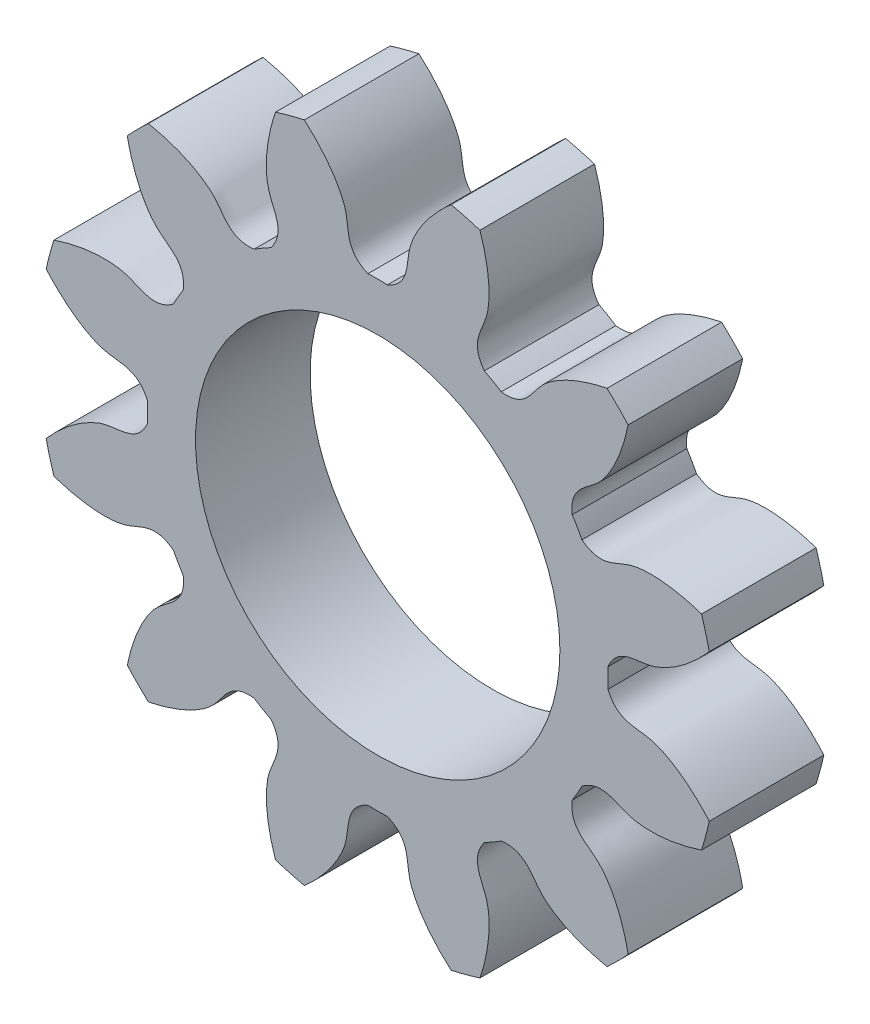
from build123d import *

# Parameters (mm, degrees)
SKETCH_1_R               = 11.853333339
EXTRUDE_1_DEPTH          = 4
CUT_EXTRUDE_1_DEPTH      = 18.233775631
PATTERN_CIRCULAR_1_COUNT = 12
SKETCH_4_R               = 6.36
CUT_EXTRUDE_2_DEPTH      = 10


with BuildPart() as part:
    # 草图1 → 凸台-拉伸1 (new body)
    with BuildSketch(Plane.XY):
        Circle(SKETCH_1_R)
    extrude(amount=EXTRUDE_1_DEPTH)

    # 草图2 → 切除-拉伸1 (cut, through all)
    with BuildSketch(Plane.XY):
        with BuildLine():
            ThreePointArc((0.340089257, 8.036140266), (0, 8.043333332), (-0.340089257, 8.036140266))
            add(Edge.make_bspline(
                [(-0.340089257, 8.036140266), (-1.152802485, 8.380827302), (-0.972605757, 9.050559634), (-1.144951038, 9.63418711), (-1.155909726, 9.668773713), (-1.168784811, 9.706751265), (-1.183712591, 9.748056173), (-1.200831778, 9.792619882), (-1.220277833, 9.840369901), (-1.242184563, 9.891229553), (-1.26668349, 9.945118118), (-1.293903901, 10.001950868), (-1.323972693, 10.061639127), (-1.357014279, 10.124090335), (-1.393150483, 10.189208114), (-1.432500435, 10.25689233), (-1.475180474, 10.327039167), (-1.521304041, 10.399541199), (-1.570981591, 10.474287463), (-1.62432049, 10.551163535), (-1.681424925, 10.630051615), (-1.74239581, 10.710830603), (-1.807330697, 10.793376185), (-1.876323688, 10.877560923), (-1.94946535, 10.963254337), (-2.026842632, 11.050323004), (-2.108538779, 11.138630643), (-2.194633261, 11.228038218), (-2.28520169, 11.318404026), (-2.380315749, 11.409583805), (-2.480043117, 11.501430831), (-2.584447403, 11.593796018), (-2.693588078, 11.686528027), (-2.807520411, 11.779473372), (-2.926295405, 11.872476524), (-3.049959741, 11.965380024), (-3.178555721, 12.058024596), (-3.312121213, 12.150249252), (-3.450689601, 12.241891415), (-3.594289737, 12.332787027), (-3.742945897, 12.422770671), (-3.896677735, 12.511675685), (-4.055500247, 12.599334283), (-4.219423733, 12.685577674), (-4.388453763, 12.770236183), (-4.562591149, 12.853139375), (-4.741831913, 12.934116174), (-4.926167263, 13.012994989), (-5.115583581, 13.08960384), (-5.31006237, 13.163770481), (-5.578482967, 13.260032674), (-5.783738495, 13.326705048), (-5.922611814, 13.368817405)],
                knots=[0, 0, 0, 0, 0.218015236, 0.222043642, 0.226545979, 0.231522246, 0.236972443, 0.24289657, 0.249294627, 0.256166614, 0.263512532, 0.271332379, 0.279626157, 0.288393865, 0.297635503, 0.307351072, 0.31754057, 0.328203999, 0.339341357, 0.350952646, 0.363037866, 0.375597015, 0.388630094, 0.402137104, 0.416118043, 0.430572913, 0.445501713, 0.460904444, 0.476781104, 0.493131694, 0.509956215, 0.527254666, 0.545027047, 0.563273358, 0.581993599, 0.601187771, 0.620855872, 0.640997904, 0.661613866, 0.682703758, 0.704267581, 0.726305333, 0.748817015, 0.771802628, 0.795262171, 0.819195644, 0.843603047, 0.868484381, 0.893839644, 0.919668838, 0.945971962, 1, 1, 1, 1], degree=3))
            ThreePointArc((-5.922611814, 13.368817405), (0, 14.621990614), (5.922611814, 13.368817405))
            add(Edge.make_bspline(
                [(0.340089257, 8.036140266), (1.152802485, 8.380827302), (0.972605757, 9.050559634), (1.144951038, 9.63418711), (1.155909726, 9.668773713), (1.168784811, 9.706751265), (1.183712591, 9.748056173), (1.200831778, 9.792619882), (1.220277833, 9.840369901), (1.242184563, 9.891229553), (1.26668349, 9.945118118), (1.293903901, 10.001950868), (1.323972693, 10.061639127), (1.357014279, 10.124090335), (1.393150483, 10.189208114), (1.432500435, 10.25689233), (1.475180474, 10.327039167), (1.521304041, 10.399541199), (1.570981591, 10.474287463), (1.62432049, 10.551163535), (1.681424925, 10.630051615), (1.74239581, 10.710830603), (1.807330697, 10.793376185), (1.876323688, 10.877560923), (1.94946535, 10.963254337), (2.026842632, 11.050323004), (2.108538779, 11.138630643), (2.194633261, 11.228038218), (2.28520169, 11.318404026), (2.380315749, 11.409583805), (2.480043117, 11.501430831), (2.584447403, 11.593796018), (2.693588078, 11.686528027), (2.807520411, 11.779473372), (2.926295405, 11.872476524), (3.049959741, 11.965380024), (3.178555721, 12.058024596), (3.312121213, 12.150249252), (3.450689601, 12.241891415), (3.594289737, 12.332787027), (3.742945897, 12.422770671), (3.896677735, 12.511675685), (4.055500247, 12.599334283), (4.219423733, 12.685577674), (4.388453763, 12.770236183), (4.562591149, 12.853139375), (4.741831913, 12.934116174), (4.926167263, 13.012994989), (5.115583581, 13.08960384), (5.31006237, 13.163770481), (5.578482967, 13.260032674), (5.783738495, 13.326705048), (5.922611814, 13.368817405)],
                knots=[0, 0, 0, 0, 0.218015236, 0.222043642, 0.226545979, 0.231522246, 0.236972443, 0.24289657, 0.249294627, 0.256166614, 0.263512532, 0.271332379, 0.279626157, 0.288393865, 0.297635503, 0.307351072, 0.31754057, 0.328203999, 0.339341357, 0.350952646, 0.363037866, 0.375597015, 0.388630094, 0.402137104, 0.416118043, 0.430572913, 0.445501713, 0.460904444, 0.476781104, 0.493131694, 0.509956215, 0.527254666, 0.545027047, 0.563273358, 0.581993599, 0.601187771, 0.620855872, 0.640997904, 0.661613866, 0.682703758, 0.704267581, 0.726305333, 0.748817015, 0.771802628, 0.795262171, 0.819195644, 0.843603047, 0.868484381, 0.893839644, 0.919668838, 0.945971962, 1, 1, 1, 1], degree=3))
        make_face()
    cut_extrude_1 = extrude(amount=CUT_EXTRUDE_1_DEPTH, mode=Mode.SUBTRACT)

    # 阵列(圆周)1: 切除-拉伸1 ×12 about axis
    pattern_circular_1_axis = Axis((0, 0, -0.2), (0, 0, 1))
    for i in range(1, PATTERN_CIRCULAR_1_COUNT):
        add(cut_extrude_1.rotate(pattern_circular_1_axis, i * 360 / PATTERN_CIRCULAR_1_COUNT), mode=Mode.SUBTRACT)

    # 草图4 → 切除-拉伸2 (cut)
    with BuildSketch(Plane.XY.offset(4)):
        Circle(SKETCH_4_R)
    extrude(amount=-CUT_EXTRUDE_2_DEPTH, mode=Mode.SUBTRACT)


solid = part.part
